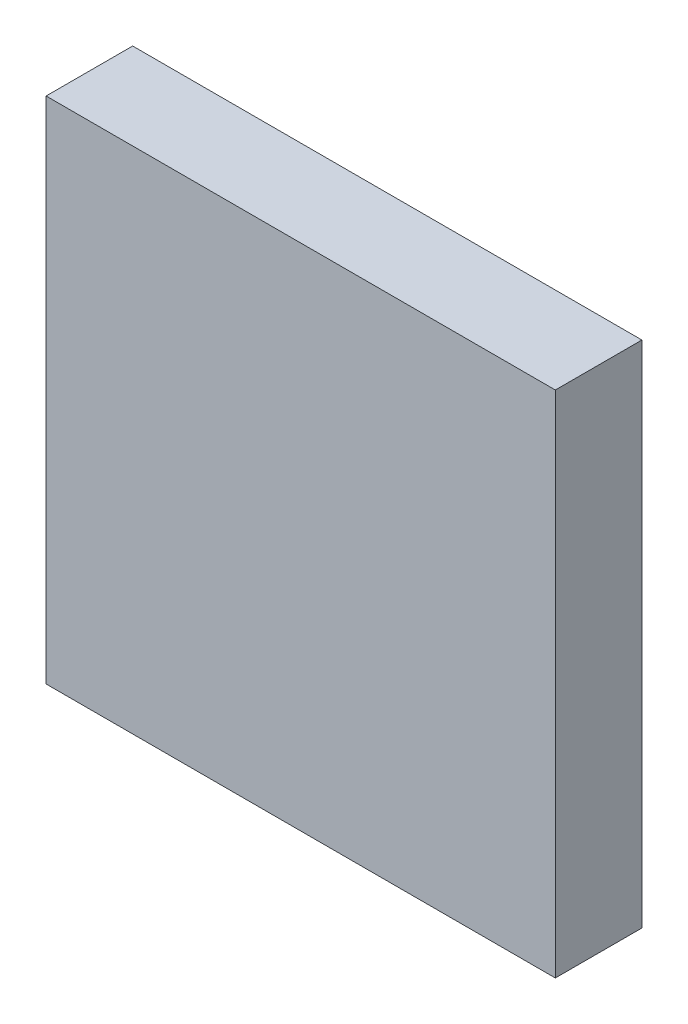
from build123d import *

# Parameters (mm, degrees)
SKETCH1_W           = 90
SKETCH1_H           = 90
BOSS_EXTRUDE1_DEPTH = 15.3


with BuildPart() as part:
    # Sketch1 → Boss-Extrude1 (new body)
    with BuildSketch(Plane.XY):
        with Locations((45, 45)):
            Rectangle(SKETCH1_W, SKETCH1_H)
    extrude(amount=BOSS_EXTRUDE1_DEPTH)


solid = part.part
